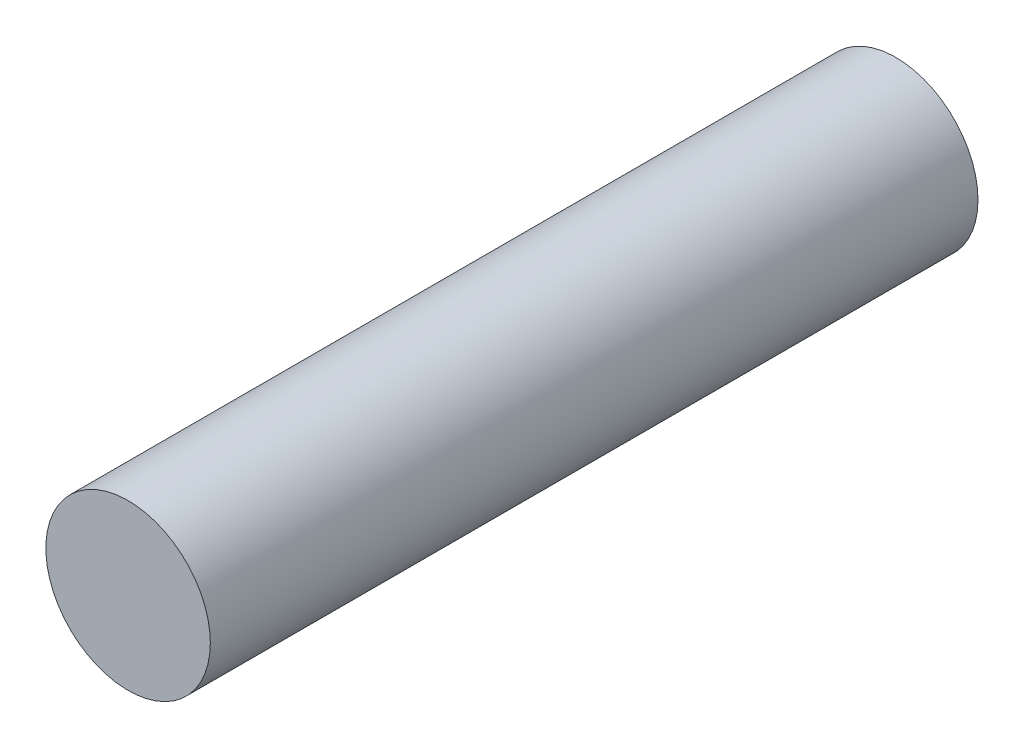
from build123d import *

# Parameters (mm, degrees)
SKETCH1_R           = 6
BOSS_EXTRUDE1_DEPTH = 28


with BuildPart() as part:
    # Sketch1 → Boss-Extrude1 (new, symmetric)
    with BuildSketch(Plane.XY):
        Circle(SKETCH1_R)
    extrude(amount=BOSS_EXTRUDE1_DEPTH, both=True)


solid = part.part
